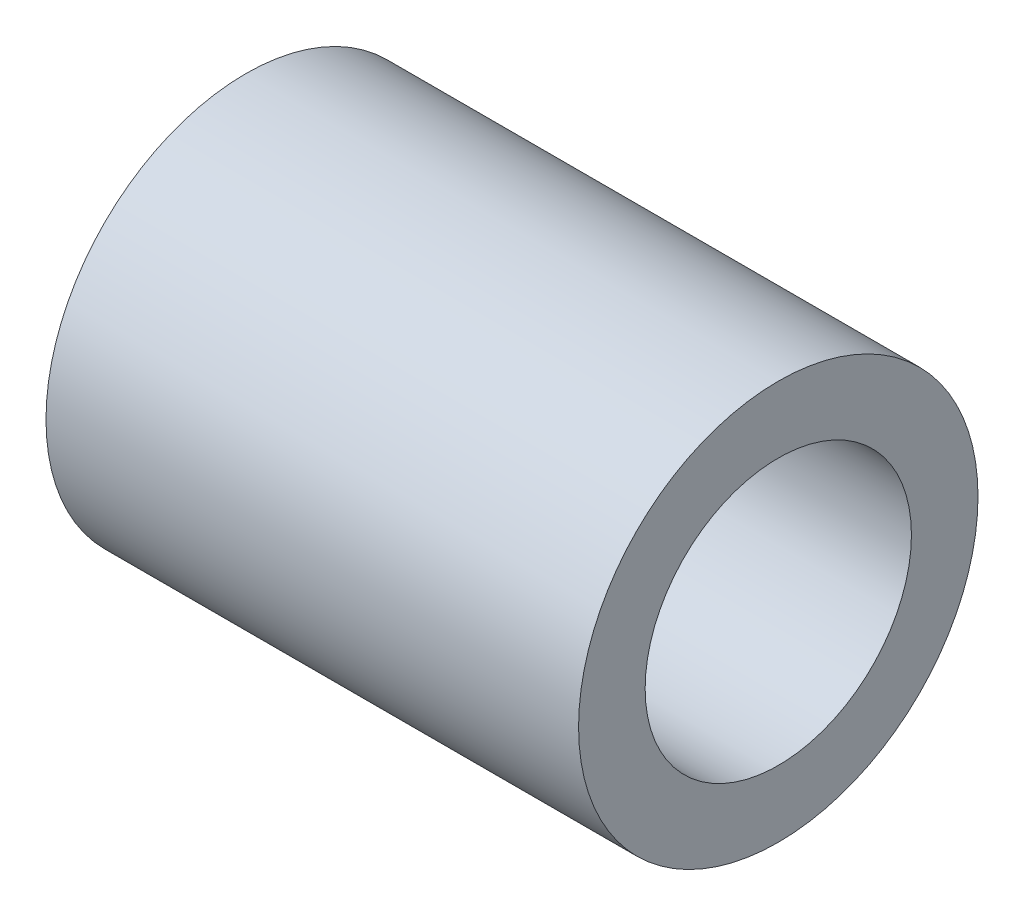
from build123d import *

# Parameters (mm, degrees)
SKETCH1_R           = 3.571875
SKETCH1_R_2         = 2.38125
BOSS_EXTRUDE1_DEPTH = 4.7625


with BuildPart() as part:
    # Sketch1 → Boss-Extrude1 (new, symmetric)
    with BuildSketch(Plane(origin=(0, 0, 0), x_dir=(0, 0, -1), z_dir=(1, 0, 0))):
        with Locations(Location((0, 0, 0), (0, 0, 180))):
            Circle(SKETCH1_R)
        with Locations(Location((0, 0, 0), (0, 0, 180))):
            Circle(SKETCH1_R_2, mode=Mode.SUBTRACT)
    extrude(amount=BOSS_EXTRUDE1_DEPTH, both=True)


solid = part.part
